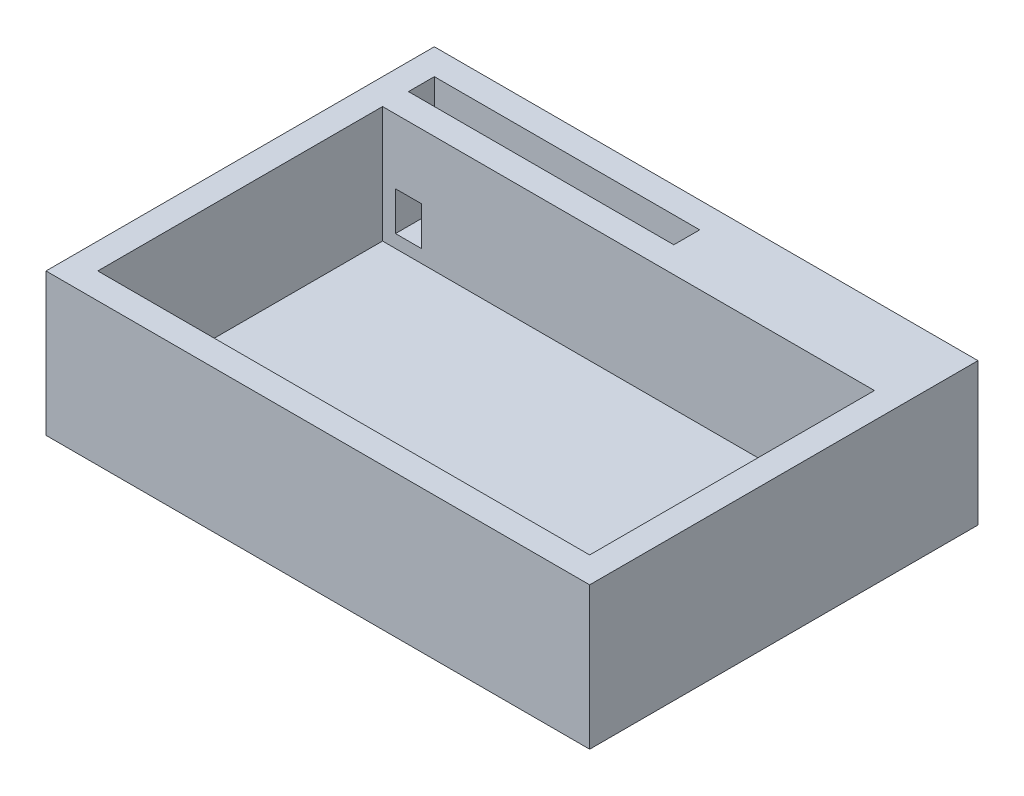
from build123d import *

# Parameters (mm, degrees)
SKETCH1_W           = 42
SKETCH1_H           = 30
BOSS_EXTRUDE1_DEPTH = 2
SKETCH2_W           = 42
SKETCH2_H           = 30
SKETCH2_W_2         = 20.5
SKETCH2_H_2         = 2
SKETCH2_W_3         = 38
SKETCH2_H_3         = 22
BOSS_EXTRUDE2_DEPTH = 9
SKETCH6_W           = 2
SKETCH6_H           = 3
CUT_EXTRUDE2_DEPTH  = 2


with BuildPart() as part:
    # Sketch1 → Boss-Extrude1 (new body)
    with BuildSketch(Plane(origin=(0, 0, 0), x_dir=(1, 0, 0), z_dir=(0, 1, 0))):
        with Locations((21, 15)):
            Rectangle(SKETCH1_W, SKETCH1_H)
    extrude(amount=BOSS_EXTRUDE1_DEPTH)

    # Sketch2 → Boss-Extrude2 (add)
    with BuildSketch(Plane(origin=(0, 2, 0), x_dir=(1, 0, 0), z_dir=(0, 1, 0))):
        with Locations((21, 15)):
            Rectangle(SKETCH2_W, SKETCH2_H)
        with Locations((12.25, 27)):
            Rectangle(SKETCH2_W_2, SKETCH2_H_2, mode=Mode.SUBTRACT)
        with Locations((21, 13)):
            Rectangle(SKETCH2_W_3, SKETCH2_H_3, mode=Mode.SUBTRACT)
    extrude(amount=BOSS_EXTRUDE2_DEPTH)

    # Sketch6 → Cut-Extrude2 (cut)
    with BuildSketch(Plane.XY.offset(-24)):
        with Locations((4, 4.5)):
            Rectangle(SKETCH6_W, SKETCH6_H)
    extrude(amount=-CUT_EXTRUDE2_DEPTH, mode=Mode.SUBTRACT)


solid = part.part
